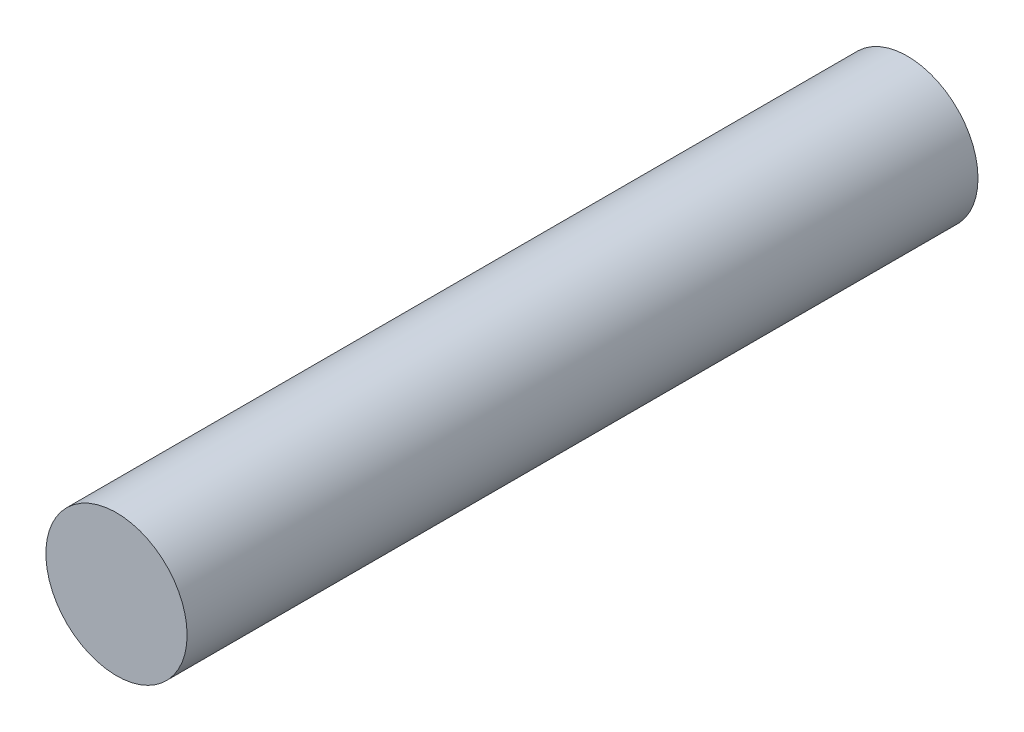
from build123d import *

# Parameters (mm, degrees)
SKETCH_1_R           = 2.5
DOUBLE_EAR_PIN_DEPTH = 28


with BuildPart() as part:
    # 草图1 → Double_ear_pin (new body)
    with BuildSketch(Plane.XY):
        Circle(SKETCH_1_R)
    extrude(amount=DOUBLE_EAR_PIN_DEPTH)


solid = part.part
